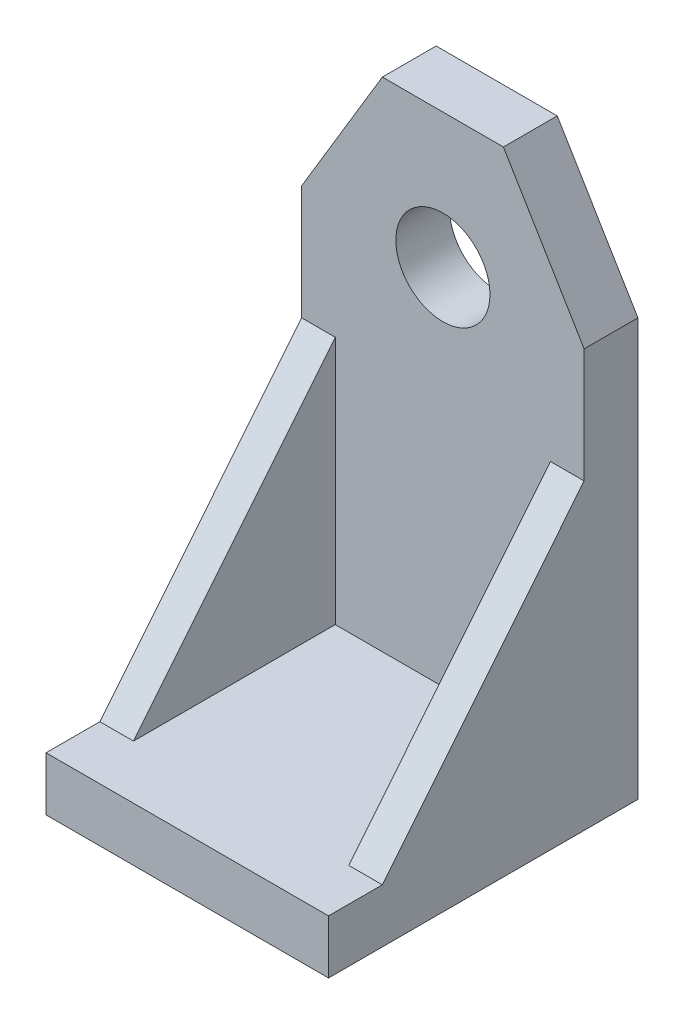
from build123d import *

# Parameters (mm, degrees)
SKETCH2_W           = 42
SKETCH2_H           = 8
BOSS_EXTRUDE1_DEPTH = 23
SKETCH3_W           = 42
SKETCH3_H           = 8
BOSS_EXTRUDE2_DEPTH = 74
CUT_EXTRUDE1_DEPTH  = 100.659420026
BOSS_EXTRUDE3_DEPTH = 5
BOSS_EXTRUDE5_DEPTH = 5
SKETCH11_R          = 7
CUT_EXTRUDE2_DEPTH  = 100.659420026


with BuildPart() as part:
    # Sketch2 → Boss-Extrude1 (new, symmetric)
    with BuildSketch(Plane.XY):
        with Locations((21, 4)):
            Rectangle(SKETCH2_W, SKETCH2_H)
    extrude(amount=BOSS_EXTRUDE1_DEPTH, both=True)

    # Sketch3 → Boss-Extrude2 (add)
    with BuildSketch(Plane(origin=(0, 8, 0), x_dir=(1, 0, 0), z_dir=(0, 1, 0))):
        with Locations((21, 19)):
            Rectangle(SKETCH3_W, SKETCH3_H)
    extrude(amount=BOSS_EXTRUDE2_DEPTH)

    # Sketch4 → Cut-Extrude1 (cut, through all)
    with BuildSketch(Plane.XY.offset(-15)):
        Polygon((0, 82), (12, 82), (0, 62), align=None)
        Polygon((30, 82), (42, 82), (42, 62), align=None)
    extrude(amount=-CUT_EXTRUDE1_DEPTH, mode=Mode.SUBTRACT)

    # Sketch6 → Boss-Extrude3 (add)
    with BuildSketch(Plane(origin=(0, 0, 0), x_dir=(0, 0, -1), z_dir=(1, 0, 0))):
        Polygon((15, 45), (-15, 8), (15, 8), align=None)
    extrude(amount=BOSS_EXTRUDE3_DEPTH)

    # Sketch10 → Boss-Extrude5 (add)
    with BuildSketch(Plane(origin=(42, 0, 0), x_dir=(0, 0, -1), z_dir=(1, 0, 0))):
        Polygon((15, 45), (-15, 8), (15, 8), align=None)
    extrude(amount=-BOSS_EXTRUDE5_DEPTH)

    # Sketch11 → Cut-Extrude2 (cut, through all)
    with BuildSketch(Plane.XY.offset(-15)):
        with Locations((21, 62)):
            Circle(SKETCH11_R)
    extrude(amount=-CUT_EXTRUDE2_DEPTH, mode=Mode.SUBTRACT)


solid = part.part
